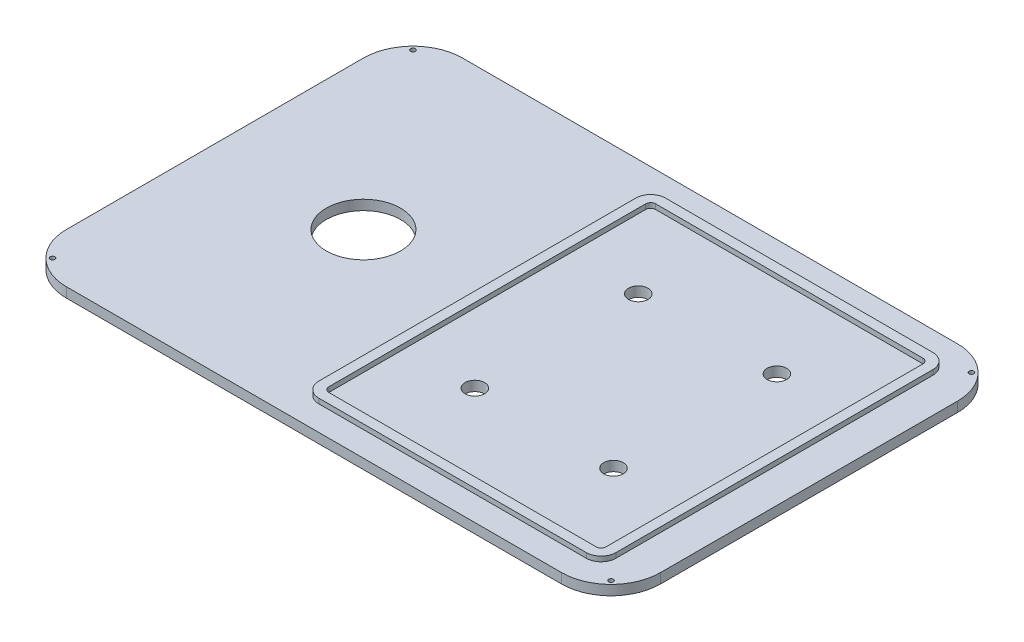
from build123d import *

# Parameters (mm, degrees)
BOSS_EXTRUDE1_DEPTH = 2.54
SKETCH2_R           = 0.6
CUT_EXTRUDE1_DEPTH  = 92.616219088
BOSS_EXTRUDE2_DEPTH = 1.27
CUT_EXTRUDE2_DEPTH  = 1.27
SKETCH5_R           = 2.499995
CUT_EXTRUDE3_DEPTH  = 92.616219088
SKETCH6_R           = 9.525
CUT_EXTRUDE4_DEPTH  = 10.16


with BuildPart() as part:
    # Sketch1 → Boss-Extrude1 (new body)
    with BuildSketch(Plane(origin=(0, 0, 0), x_dir=(1, 0, 0), z_dir=(0, 1, 0))):
        with BuildLine():
            Line((63.5, 50.8), (-63.5, 50.8))
            ThreePointArc((-63.5, 50.8), (-72.480256121, 47.080256121), (-76.2, 38.1))
            Line((-76.2, 38.1), (-76.2, -38.1))
            ThreePointArc((-76.2, -38.1), (-72.480256121, -47.080256121), (-63.5, -50.8))
            Line((-63.5, -50.8), (63.5, -50.8))
            ThreePointArc((63.5, -50.8), (72.480256121, -47.080256121), (76.2, -38.1))
            Line((76.2, -38.1), (76.2, 38.1))
            ThreePointArc((76.2, 38.1), (72.480256121, 47.080256121), (63.5, 50.8))
        make_face()
    extrude(amount=BOSS_EXTRUDE1_DEPTH)

    # Sketch2 → Cut-Extrude1 (cut, through all)
    with BuildSketch(Plane(origin=(0, 2.54, 0), x_dir=(1, 0, 0), z_dir=(0, 1, 0))):
        with Locations(Location((-71.628, 46.228, 0), (0, 0, 270))):
            Circle(SKETCH2_R)
        with Locations(Location((-71.628, -46.228, 0), (0, 0, 270))):
            Circle(SKETCH2_R)
        with Locations(Location((71.628, -46.228, 0), (0, 0, 270))):
            Circle(SKETCH2_R)
        with Locations(Location((71.628, 46.228, 0), (0, 0, 270))):
            Circle(SKETCH2_R)
    extrude(amount=-CUT_EXTRUDE1_DEPTH, mode=Mode.SUBTRACT)

    # Sketch3 → Boss-Extrude2 (add)
    with BuildSketch(Plane(origin=(0, 2.54, 0), x_dir=(1, 0, 0), z_dir=(0, 1, 0))):
        with BuildLine():
            Line((63.5, 44.45), (-5.08, 44.45))
            ThreePointArc((-5.08, 44.45), (-7.774076836, 43.334076836), (-8.89, 40.64))
            Line((-8.89, 40.64), (-8.89, -40.64))
            ThreePointArc((-8.89, -40.64), (-7.774076836, -43.334076836), (-5.08, -44.45))
            Line((-5.08, -44.45), (63.5, -44.45))
            ThreePointArc((63.5, -44.45), (66.194076836, -43.334076836), (67.31, -40.64))
            Line((67.31, -40.64), (67.31, 40.64))
            ThreePointArc((67.31, 40.64), (66.194076836, 43.334076836), (63.5, 44.45))
        make_face()
    extrude(amount=BOSS_EXTRUDE2_DEPTH)

    # Sketch4 → Cut-Extrude2 (cut)
    with BuildSketch(Plane(origin=(0, 3.81, 0), x_dir=(1, 0, 0), z_dir=(0, 1, 0))):
        with BuildLine():
            Line((-5.08, 41.91), (63.5, 41.91))
            ThreePointArc((63.5, 41.91), (64.398025612, 41.538025612), (64.77, 40.64))
            Line((64.77, 40.64), (64.77, -40.64))
            ThreePointArc((64.77, -40.64), (64.398025612, -41.538025612), (63.5, -41.91))
            Line((63.5, -41.91), (-5.08, -41.91))
            ThreePointArc((-5.08, -41.91), (-5.978025612, -41.538025612), (-6.35, -40.64))
            Line((-6.35, -40.64), (-6.35, 40.64))
            ThreePointArc((-6.35, 40.64), (-5.978025612, 41.538025612), (-5.08, 41.91))
        make_face()
    extrude(amount=-CUT_EXTRUDE2_DEPTH, mode=Mode.SUBTRACT)

    # Sketch5 → Cut-Extrude3 (cut, through all)
    with BuildSketch(Plane(origin=(0, 2.54, 0), x_dir=(1, 0, 0), z_dir=(0, 1, 0))):
        with Locations(Location((11.43, 20.955, 0), (0, 0, 270))):
            Circle(SKETCH5_R)
        with Locations(Location((46.99, 20.955, 0), (0, 0, 270))):
            Circle(SKETCH5_R)
        with Locations(Location((11.43, -20.955, 0), (0, 0, 270))):
            Circle(SKETCH5_R)
        with Locations(Location((46.99, -20.955, 0), (0, 0, 270))):
            Circle(SKETCH5_R)
    extrude(amount=-CUT_EXTRUDE3_DEPTH, mode=Mode.SUBTRACT)

    # Sketch6 → Cut-Extrude4 (cut)
    with BuildSketch(Plane(origin=(0, 2.54, 0), x_dir=(1, 0, 0), z_dir=(0, 1, 0))):
        with Locations(Location((-38.1, 0, 0), (0, 0, 270))):
            Circle(SKETCH6_R)
    extrude(amount=-CUT_EXTRUDE4_DEPTH, mode=Mode.SUBTRACT)


solid = part.part
